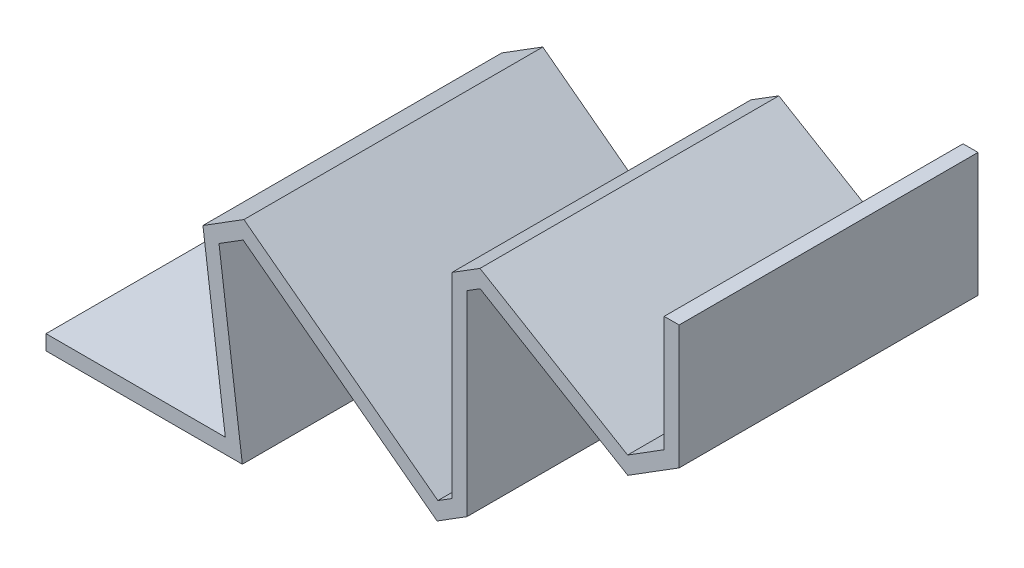
from build123d import *

# Parameters (mm, degrees)
BOSS_EXTRUDE1_DEPTH = 2.5


with BuildPart() as part:
    # frame_outline → Boss-Extrude1 (new, symmetric)
    with BuildSketch(Plane.XY):
        Polygon((0, 0), (0, 0.25), (3, 0.25), (2.625519601, 3.130114195), (3.311145122, 3.558555133), (6.555598399, 1.109884861), (6.792166473, 1.257714025), (6.792166473, 4.533228245), (7.259759156, 4.825422514), (9.729524263, 3.356316312), (10.341620659, 3.738809591), (10.341620659, 5.671508671), (10.591620659, 5.671508671), (10.591620659, 3.600234825), (9.732731436, 3.063523029), (7.262966329, 4.532629231), (7.042166473, 4.394653478), (7.042166473, 1.119139258), (6.542252093, 0.806747465), (3.297798816, 3.255417737), (2.894129781, 3.003168755), (3.284610073, 0), (3, 0), align=None)
    extrude(amount=BOSS_EXTRUDE1_DEPTH, both=True)


solid = part.part
